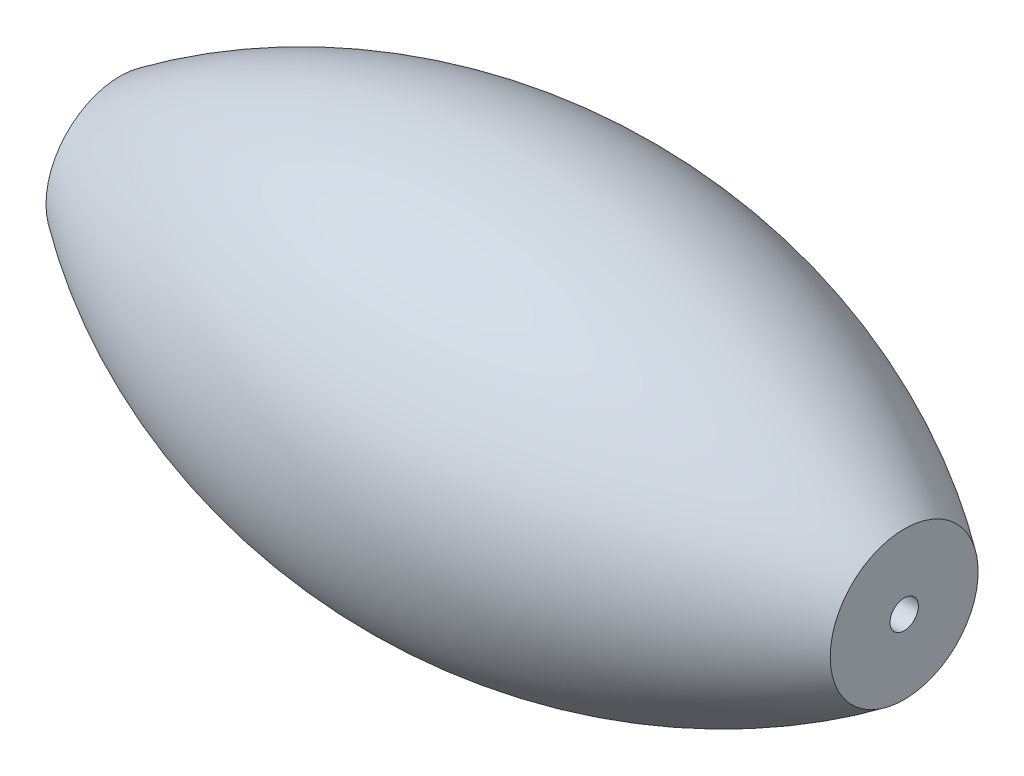
from build123d import *

# Parameters (mm, degrees)
TALADRO_DE_MARGEN_PARA_81_D = 4.4958


with BuildPart() as part:
    # Croquis2 → Revolución1 (revolve)
    with BuildSketch(Plane.XY, mode=Mode.PRIVATE) as revoluci_n1_sk:
        with BuildLine():
            Line((-62.133394455, 86.513967662), (-62.133394455, 74.794486468))
            Line((-62.133394455, 74.794486468), (62.133394455, 74.794486468))
            Line((62.133394455, 74.794486468), (62.133394455, 86.513967662))
            ThreePointArc((62.133394455, 86.513967662), (0, 106.513967662), (-62.133394455, 86.513967662))
        make_face()
    revolve(revoluci_n1_sk.sketch.rotate(Axis((-62.133394455, 74.794486468, 0), (1, 0, 0)), 90), axis=Axis((-62.133394455, 74.794486468, 0), (1, 0, 0)))

    # Taladro de margen para #81 (through all)
    with Locations(Plane(origin=(62.133394455, 0, 0), x_dir=(0, 0, -1), z_dir=(1, 0, 0))):
        with Locations((0, 74.794486468)):
            Hole(TALADRO_DE_MARGEN_PARA_81_D / 2)


solid = part.part
